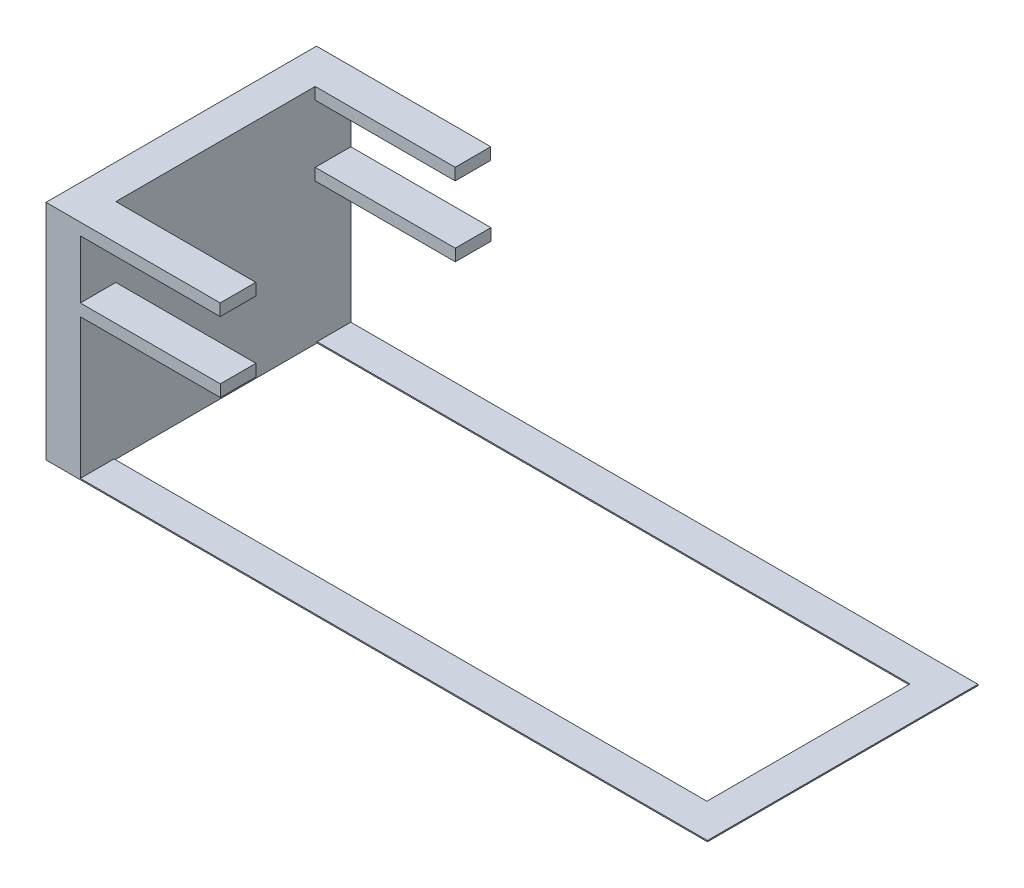
from build123d import *

# Parameters (mm, degrees)
SKETCH1_W           = 1416.83235241
SKETCH1_H           = 579.478309122
SKETCH1_W_2         = 1270
SKETCH1_H_2         = 434.999892
BOSS_EXTRUDE1_DEPTH = 2.54
SKETCH2_W           = 73.416176205
SKETCH2_H           = 579.478309122
BOSS_EXTRUDE2_DEPTH = 327.9394
SKETCH3_W           = 76.2
SKETCH3_H           = 25.4
BOSS_EXTRUDE3_DEPTH = 299.9994
SKETCH4_W           = 73.416176205
SKETCH4_H           = 579.478309122
BOSS_EXTRUDE4_DEPTH = 149.999954
SKETCH5_W           = 76.2
SKETCH5_H           = 25.4
BOSS_EXTRUDE5_DEPTH = 299.72


with BuildPart() as part:
    # Sketch1 → Boss-Extrude1 (new body)
    with BuildSketch(Plane(origin=(0, 0, 0), x_dir=(1, 0, 0), z_dir=(0, 1, 0))):
        Rectangle(SKETCH1_W, SKETCH1_H)
        Rectangle(SKETCH1_W_2, SKETCH1_H_2, mode=Mode.SUBTRACT)
    extrude(amount=BOSS_EXTRUDE1_DEPTH)

    # Sketch2 → Boss-Extrude2 (add)
    with BuildSketch(Plane.XZ):
        with Locations((-671.708088103, 0)):
            Rectangle(SKETCH2_W, SKETCH2_H)
    extrude(amount=-BOSS_EXTRUDE2_DEPTH)

    # Sketch3 → Boss-Extrude3 (add)
    with BuildSketch(Plane(origin=(-635, 0, 0), x_dir=(0, 0, -1), z_dir=(1, 0, 0))):
        with Locations((-251.639154561, 315.2394)):
            Rectangle(SKETCH3_W, SKETCH3_H)
        with Locations((251.639154561, 315.2394)):
            Rectangle(SKETCH3_W, SKETCH3_H)
    extrude(amount=BOSS_EXTRUDE3_DEPTH)

    # Sketch4 → Boss-Extrude4 (add)
    with BuildSketch(Plane(origin=(0, 327.9394, 0), x_dir=(1, 0, 0), z_dir=(0, 1, 0))):
        with Locations((-671.708088103, 0)):
            Rectangle(SKETCH4_W, SKETCH4_H)
    extrude(amount=BOSS_EXTRUDE4_DEPTH)

    # Sketch5 → Boss-Extrude5 (add)
    with BuildSketch(Plane(origin=(-635, 0, 0), x_dir=(0, 0, -1), z_dir=(1, 0, 0))):
        with Locations((-251.639154561, 465.239354)):
            Rectangle(SKETCH5_W, SKETCH5_H)
        with Locations((251.639154561, 465.239354)):
            Rectangle(SKETCH5_W, SKETCH5_H)
    extrude(amount=BOSS_EXTRUDE5_DEPTH)


solid = part.part
